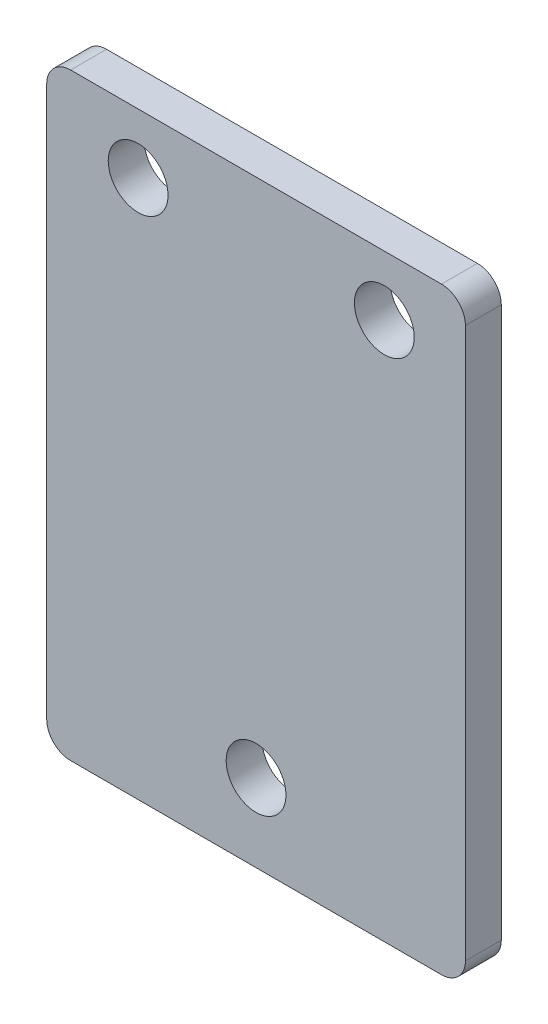
from build123d import *

# Parameters (mm, degrees)
SKETCH1_R           = 2.5
BOSS_EXTRUDE1_DEPTH = 3


with BuildPart() as part:
    # Sketch1 → Boss-Extrude1 (new body)
    with BuildSketch(Plane(origin=(0, 0, 0), x_dir=(1, 0, 0), z_dir=(0, 0, -1))):
        with BuildLine():
            Line((-15.5, 35), (15.5, 35))
            ThreePointArc((15.5, 35), (16.914213562, 34.414213562), (17.5, 33))
            Line((17.5, 33), (17.5, -13))
            ThreePointArc((17.5, -13), (16.914213562, -14.414213562), (15.5, -15))
            Line((15.5, -15), (-15.5, -15))
            ThreePointArc((-15.5, -15), (-16.914213562, -14.414213562), (-17.5, -13))
            Line((-17.5, -13), (-17.5, 33))
            ThreePointArc((-17.5, 33), (-16.914213562, 34.414213562), (-15.5, 35))
        make_face()
        with Locations(Location((0, 28.5, 0), (0, 0, 180))):
            Circle(SKETCH1_R, mode=Mode.SUBTRACT)
        with Locations(Location((-9.858841032, -10, 0), (0, 0, 180))):
            Circle(SKETCH1_R, mode=Mode.SUBTRACT)
        with Locations(Location((10.720755397, -10, 0), (0, 0, 180))):
            Circle(SKETCH1_R, mode=Mode.SUBTRACT)
    extrude(amount=BOSS_EXTRUDE1_DEPTH)


solid = part.part
